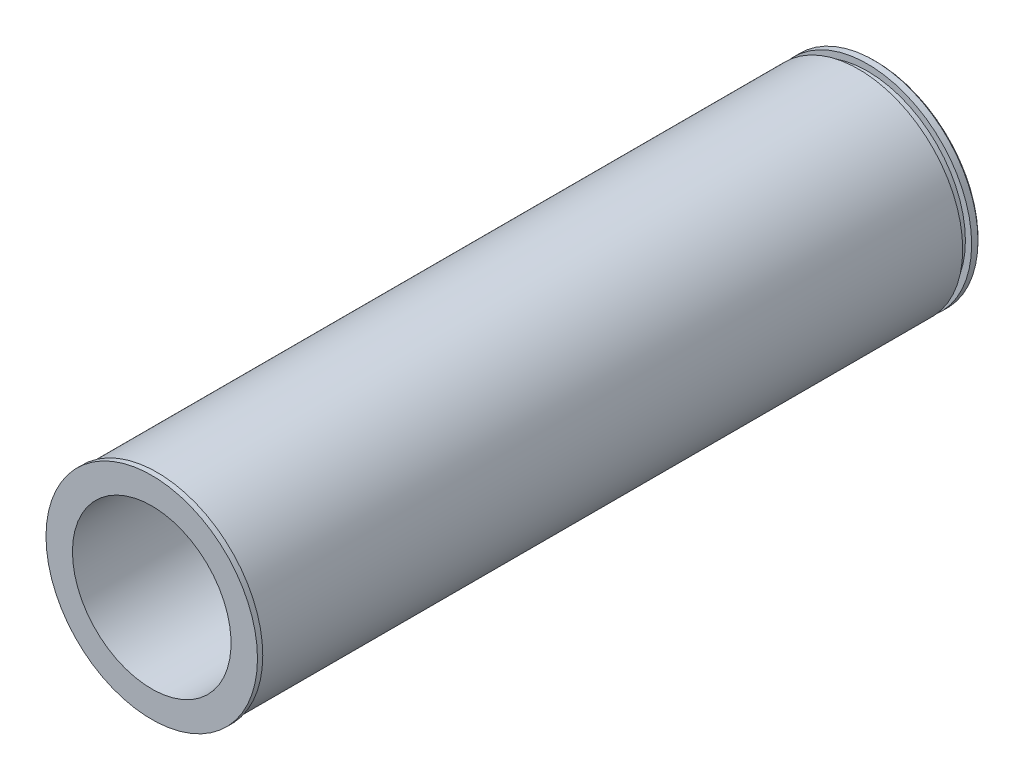
from build123d import *

# Parameters (mm, degrees)
CHAMFER1_SIZE = 0.508


with BuildPart() as part:
    # Sketch1 → Revolve1 (revolve)
    with BuildSketch(Plane(origin=(0, 0, 0), x_dir=(0, 0, -1), z_dir=(1, 0, 0)), mode=Mode.PRIVATE) as revolve1_sk:
        Polygon((-85.5345, 19.05), (88.4465, 19.05), (88.4465, 25), (86.4145, 25), (86.4145, 23.5), (84.2645, 23.5), (84.2645, 25), (-84.2645, 25), (-84.2645, 25.4), (-85.5345, 25.4), align=None)
    revolve(revolve1_sk.sketch.rotate(Axis((0, 0, 0), (0, 0, 1)), 90), axis=Axis((0, 0, 0), (0, 0, 1)))

    # Chamfer1
    chamfer1_edges = [part.edges().sort_by_distance(p)[0] for p in [
        (25, 0, -88.4465),
    ]]
    chamfer(chamfer1_edges, length=CHAMFER1_SIZE)


solid = part.part
